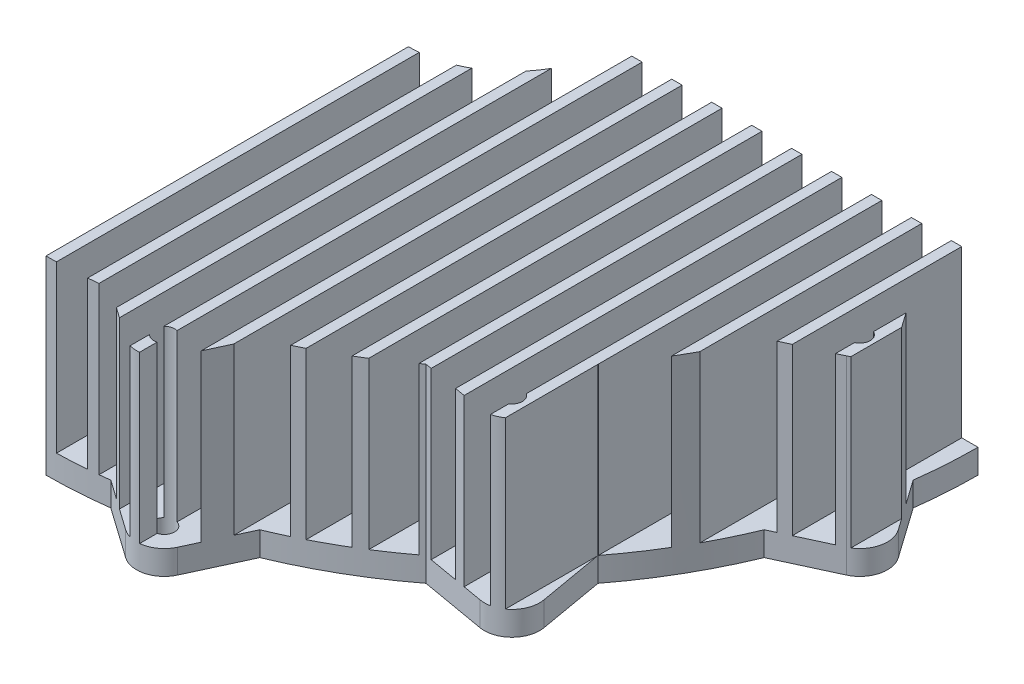
from build123d import *

# Parameters (mm, degrees)
BOSS_EXTRUDE1_DEPTH = 1000
SKETCH2_R           = 3
CUT_EXTRUDE2_DEPTH  = 1016.012315196
SKETCH3_R           = 30
CUT_EXTRUDE3_DEPTH  = 67


with BuildPart() as part:
    # Sketch1 → Boss-Extrude1 (new body)
    with BuildSketch(Plane.XY):
        Polygon((11.571428571, 55), (11.571428571, 7), (3, 7), (3, 55), (0, 55), (0, 7), (0, 0), (165, 0), (165, 7), (165, 10), (165, 55), (162, 55), (162, 7), (153.428571429, 7), (153.428571429, 55), (150.428571429, 55), (150.428571429, 7), (141.857142857, 7), (141.857142857, 55), (138.857142857, 55), (138.857142857, 7), (130.285714286, 7), (130.285714286, 55), (127.285714286, 55), (127.285714286, 7), (118.714285714, 7), (118.714285714, 55), (115.714285714, 55), (115.714285714, 7), (107.142857143, 7), (107.142857143, 55), (104.142857143, 55), (104.142857143, 7), (95.571428571, 7), (95.571428571, 55), (92.571428571, 55), (92.571428571, 7), (84, 7), (84, 55), (81, 55), (81, 7), (72.428571429, 7), (72.428571429, 55), (69.428571429, 55), (69.428571429, 7), (60.857142857, 7), (60.857142857, 55), (57.857142857, 55), (57.857142857, 7), (49.285714286, 7), (49.285714286, 55), (46.285714286, 55), (46.285714286, 7), (37.714285714, 7), (37.714285714, 55), (34.714285714, 55), (34.714285714, 7), (26.142857143, 7), (26.142857143, 55), (23.142857143, 55), (23.142857143, 7), (14.571428571, 7), (14.571428571, 55), align=None)
    extrude(amount=BOSS_EXTRUDE1_DEPTH)

    # Sketch2 → Cut-Extrude2 (cut, through all)
    with BuildSketch(Plane.XZ):
        with BuildLine():
            Line((0, 1000), (0, 135))
            ThreePointArc((0, 135), (8.829422446, 134.710954637), (17.62103595, 133.845056285))
            Line((17.62103595, 133.845056285), (32.26946717, 144.181033328))
            ThreePointArc((32.26946717, 144.181033328), (38.952266288, 145.371836857), (44.144338328, 140.999171191))
            Line((44.144338328, 140.999171191), (51.662263369, 124.723736889))
            ThreePointArc((51.662263369, 124.723736889), (67.5, 116.913429511), (82.182792916, 107.102700939))
            Line((82.182792916, 107.102700939), (101.156071179, 110.411535956))
            ThreePointArc((101.156071179, 110.411535956), (108.187337522, 108.187337522), (110.411535956, 101.156071179))
            Line((110.411535956, 101.156071179), (107.102700939, 82.182792916))
            ThreePointArc((107.102700939, 82.182792916), (116.913429511, 67.5), (124.723736889, 51.662263369))
            Line((124.723736889, 51.662263369), (140.999171191, 44.144338328))
            ThreePointArc((140.999171191, 44.144338328), (145.371836857, 38.952266288), (144.181033328, 32.26946717))
            Line((144.181033328, 32.26946717), (133.845056285, 17.62103595))
            ThreePointArc((133.845056285, 17.62103595), (134.710954637, 8.829422446), (135, 0))
            Line((135, 0), (165, 0))
            Line((165, 0), (165, 1000))
            Line((165, 1000), (0, 1000))
        make_face()
        with Locations(Location((36.881713927, 137.644430246, 0), (0, 0, 270))):
            Circle(SKETCH2_R)
        with Locations(Location((102.530483272, 102.530483272, 0), (0, 0, 270))):
            Circle(SKETCH2_R)
        with Locations(Location((137.644430246, 36.881713927, 0), (0, 0, 270))):
            Circle(SKETCH2_R)
    extrude(amount=-CUT_EXTRUDE2_DEPTH, mode=Mode.SUBTRACT)

    # Sketch3 → Cut-Extrude3 (cut)
    with BuildSketch(Plane(origin=(0, 55, 0), x_dir=(1, 0, 0), z_dir=(0, 1, 0))):
        Circle(SKETCH3_R)
    extrude(amount=-CUT_EXTRUDE3_DEPTH, mode=Mode.SUBTRACT)


solid = part.part
